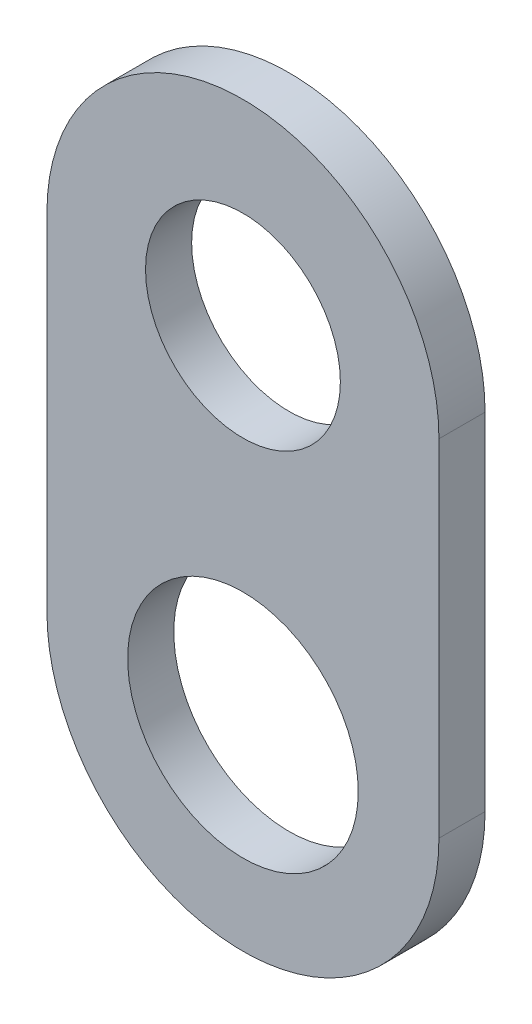
from build123d import *

# Parameters (mm, degrees)
SKETCH1_R           = 10.7315
SKETCH1_R_2         = 12.7
BOSS_EXTRUDE1_DEPTH = 5.08


with BuildPart() as part:
    # Sketch1 → Boss-Extrude1 (new body)
    with BuildSketch(Plane.XY):
        with BuildLine():
            Line((-21.59, -38.1), (-21.59, 0))
            ThreePointArc((-21.59, 0), (0, 21.59), (21.59, 0))
            Line((21.59, 0), (21.59, -38.1))
            ThreePointArc((21.59, -38.1), (0, -59.69), (-21.59, -38.1))
        make_face()
        Circle(SKETCH1_R, mode=Mode.SUBTRACT)
        with Locations((0, -38.1)):
            Circle(SKETCH1_R_2, mode=Mode.SUBTRACT)
    extrude(amount=BOSS_EXTRUDE1_DEPTH)


solid = part.part
